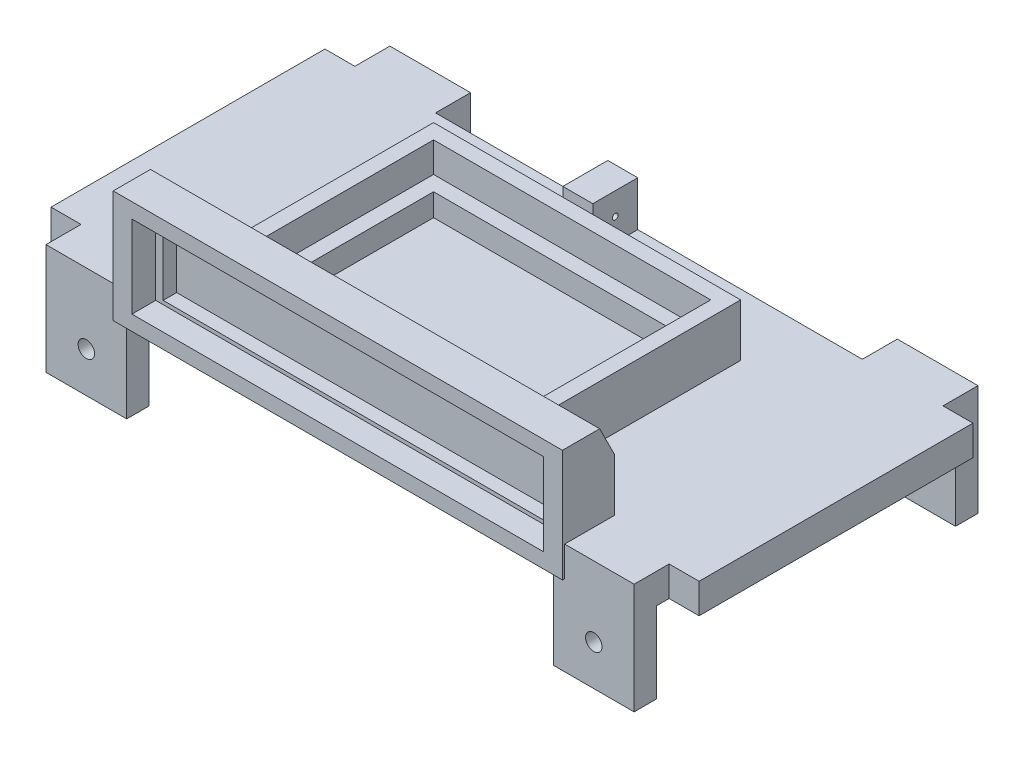
from build123d import *

# Parameters (mm, degrees)
SKETCH1_W               = 36.575
SKETCH1_H               = 41.655
SKETCH1_W_2             = 28.575
SKETCH1_H_2             = 33.655
BOSS_EXTRUDE1_DEPTH     = 41.275
SKETCH2_W               = 36.575
SKETCH2_H               = 41.655
BOSS_EXTRUDE2_DEPTH     = 2
SKETCH4_W               = 86.55
SKETCH4_H               = 36.575
CUT_EXTRUDE2_DEPTH      = 37.655
SKETCH5_W               = 10.7752
SKETCH5_H               = 4
BOSS_EXTRUDE3_DEPTH     = 1.6764
SKETCH6_W               = 10.7752
SKETCH6_H               = 14.7752
SKETCH6_R               = 1.1
BOSS_EXTRUDE4_DEPTH     = 3
MIRROR3_COPY_1_SKETCH_W = 10.7752
MIRROR3_COPY_1_SKETCH_H = 4
MIRROR3_COPY_1_DEPTH    = 1.6764
MIRROR3_COPY_2_SKETCH_W = 10.7752
MIRROR3_COPY_2_SKETCH_H = 14.7752
MIRROR3_COPY_2_SKETCH_R = 1.1
MIRROR3_COPY_2_DEPTH    = 3
SKETCH7_W               = 4
SKETCH7_H               = 6
BOSS_EXTRUDE5_DEPTH     = 6
SKETCH8_R               = 0.381
CUT_EXTRUDE3_DEPTH      = 58.021122047
SKETCH9_W               = 41.02
SKETCH9_H               = 28.32
SKETCH9_W_2             = 33.02
SKETCH9_H_2             = 20.32
BOSS_EXTRUDE6_DEPTH     = 3
SKETCH10_W              = 41.02
SKETCH10_H              = 28.32
SKETCH10_W_2            = 37.02
SKETCH10_H_2            = 24.32
BOSS_EXTRUDE7_DEPTH     = 4
BOSS_EXTRUDE8_DEPTH     = 30
BOSS_EXTRUDE9_DEPTH     = 3.5
SKETCH13_W              = 55
SKETCH13_H              = 11
CUT_EXTRUDE4_DEPTH      = 3.175


with BuildPart() as part:
    # Sketch1 → Boss-Extrude1 (new, symmetric)
    with BuildSketch(Plane(origin=(0, 0, 0), x_dir=(0, 0, -1), z_dir=(1, 0, 0))):
        Rectangle(SKETCH1_W, SKETCH1_H)
        Rectangle(SKETCH1_W_2, SKETCH1_H_2, mode=Mode.SUBTRACT)
    extrude(amount=BOSS_EXTRUDE1_DEPTH, both=True)

    # Sketch2 → Boss-Extrude2 (add)
    with BuildSketch(Plane.ZY.offset(41.275)):
        Rectangle(SKETCH2_W, SKETCH2_H)
    boss_extrude2 = extrude(amount=BOSS_EXTRUDE2_DEPTH)

    # Mirror1: Boss-Extrude2 across plane
    add(boss_extrude2.mirror(Plane(origin=(0, 0, 0), x_dir=(0, 0, 1), z_dir=(1, 0, 0))))

    # Sketch4 → Cut-Extrude2 (cut)
    with BuildSketch(Plane.XZ.offset(20.8275)):
        Rectangle(SKETCH4_W, SKETCH4_H)
    extrude(amount=-CUT_EXTRUDE2_DEPTH, mode=Mode.SUBTRACT)

    # Sketch5 → Boss-Extrude3 (add)
    with BuildSketch(Plane(origin=(0, 0, -18.2875), x_dir=(-1, 0, 0), z_dir=(0, 0, -1))):
        with Locations((-33.8874, 18.8275)):
            Rectangle(SKETCH5_W, SKETCH5_H)
    boss_extrude3 = extrude(amount=BOSS_EXTRUDE3_DEPTH)

    # Sketch6 → Boss-Extrude4 (add)
    with BuildSketch(Plane(origin=(0, 0, -19.9639), x_dir=(-1, 0, 0), z_dir=(0, 0, -1))):
        with Locations((-33.8874, 13.4399)):
            Rectangle(SKETCH6_W, SKETCH6_H)
        with Locations((-33.8874, 11.4399)):
            Circle(SKETCH6_R, mode=Mode.SUBTRACT)
    boss_extrude4 = extrude(amount=BOSS_EXTRUDE4_DEPTH)

    # Mirror2: Boss-Extrude3, Boss-Extrude4 across plane
    add(boss_extrude3.mirror(Plane(origin=(0, 0, 0), x_dir=(0, 0, 1), z_dir=(1, 0, 0))))
    add(boss_extrude4.mirror(Plane(origin=(0, 0, 0), x_dir=(0, 0, 1), z_dir=(1, 0, 0))))

    # Mirror3: Boss-Extrude3, Boss-Extrude4 across plane
    add(boss_extrude3.mirror(Plane.XY))
    add(boss_extrude4.mirror(Plane.XY))

    # Mirror3 copy 1 sketch → Mirror3 copy 1 (add)
    with BuildSketch(Plane.XY.offset(18.2875)):
        with Locations((-33.8874, 18.8275)):
            Rectangle(MIRROR3_COPY_1_SKETCH_W, MIRROR3_COPY_1_SKETCH_H)
    extrude(amount=MIRROR3_COPY_1_DEPTH)

    # Mirror3 copy 2 sketch → Mirror3 copy 2 (add)
    with BuildSketch(Plane.XY.offset(19.9639)):
        with Locations((-33.8874, 13.4399)):
            Rectangle(MIRROR3_COPY_2_SKETCH_W, MIRROR3_COPY_2_SKETCH_H)
        with Locations((-33.8874, 11.4399)):
            Circle(MIRROR3_COPY_2_SKETCH_R, mode=Mode.SUBTRACT)
    extrude(amount=MIRROR3_COPY_2_DEPTH)

    # Sketch7 → Boss-Extrude5 (add)
    with BuildSketch(Plane(origin=(0, 20.8275, 0), x_dir=(1, 0, 0), z_dir=(0, 1, 0))):
        with Locations((-3.495, 15.2875)):
            Rectangle(SKETCH7_W, SKETCH7_H)
    extrude(amount=BOSS_EXTRUDE5_DEPTH)

    # Sketch8 → Cut-Extrude3 (cut, through all)
    with BuildSketch(Plane(origin=(-1.495, 0, 0), x_dir=(0, 0, -1), z_dir=(1, 0, 0))):
        with Locations((15.2875, 23.8275)):
            Circle(SKETCH8_R)
    extrude(amount=-CUT_EXTRUDE3_DEPTH, mode=Mode.SUBTRACT)

    # Sketch9 → Boss-Extrude6 (add)
    with BuildSketch(Plane(origin=(0, 20.8275, 0), x_dir=(1, 0, 0), z_dir=(0, 1, 0))):
        with Locations((0, -4.1275)):
            Rectangle(SKETCH9_W, SKETCH9_H)
        with Locations((0, -4.1275)):
            Rectangle(SKETCH9_W_2, SKETCH9_H_2, mode=Mode.SUBTRACT)
    extrude(amount=BOSS_EXTRUDE6_DEPTH)

    # Sketch10 → Boss-Extrude7 (add)
    with BuildSketch(Plane(origin=(0, 23.8275, 0), x_dir=(1, 0, 0), z_dir=(0, 1, 0))):
        with Locations((0, -4.1275)):
            Rectangle(SKETCH10_W, SKETCH10_H)
        with Locations((0, -4.1275)):
            Rectangle(SKETCH10_W_2, SKETCH10_H_2, mode=Mode.SUBTRACT)
    extrude(amount=BOSS_EXTRUDE7_DEPTH)

    # Sketch11 → Boss-Extrude8 (add, symmetric)
    with BuildSketch(Plane(origin=(0, 0, 0), x_dir=(0, 0, -1), z_dir=(1, 0, 0))):
        Polygon((-18.2875, 31.8275), (-23.2625, 31.8275), (-23.2625, 29.8275), (-20.0875, 29.8275), (-20.0875, 29.3275), (-18.2875, 29.3275), (-18.2875, 19.3275), (-20.0875, 19.3275), (-20.0875, 18.8275), (-23.2625, 18.8275), (-23.2625, 16.8275), (-18.2875, 16.8275), (-16.2875, 16.8275), (-16.2875, 27.8275), align=None)
    extrude(amount=BOSS_EXTRUDE8_DEPTH, both=True)

    # Sketch12 → Boss-Extrude9 (add)
    with BuildSketch(Plane.ZY.offset(30)):
        Polygon((23.2625, 29.8275), (23.2625, 18.8275), (18.2875, 18.8275), (18.2875, 29.3275), (20.0875, 29.3275), (20.0875, 29.8275), align=None)
    boss_extrude9 = extrude(amount=-BOSS_EXTRUDE9_DEPTH)

    # Mirror4: Boss-Extrude9 across plane
    add(boss_extrude9.mirror(Plane(origin=(0, 0, 0), x_dir=(0, 0, 1), z_dir=(1, 0, 0))))

    # Sketch13 → Cut-Extrude4 (cut)
    with BuildSketch(Plane.XY.offset(23.2625)):
        with Locations((0, 24.3275)):
            Rectangle(SKETCH13_W, SKETCH13_H)
    extrude(amount=-CUT_EXTRUDE4_DEPTH, mode=Mode.SUBTRACT)


solid = part.part
